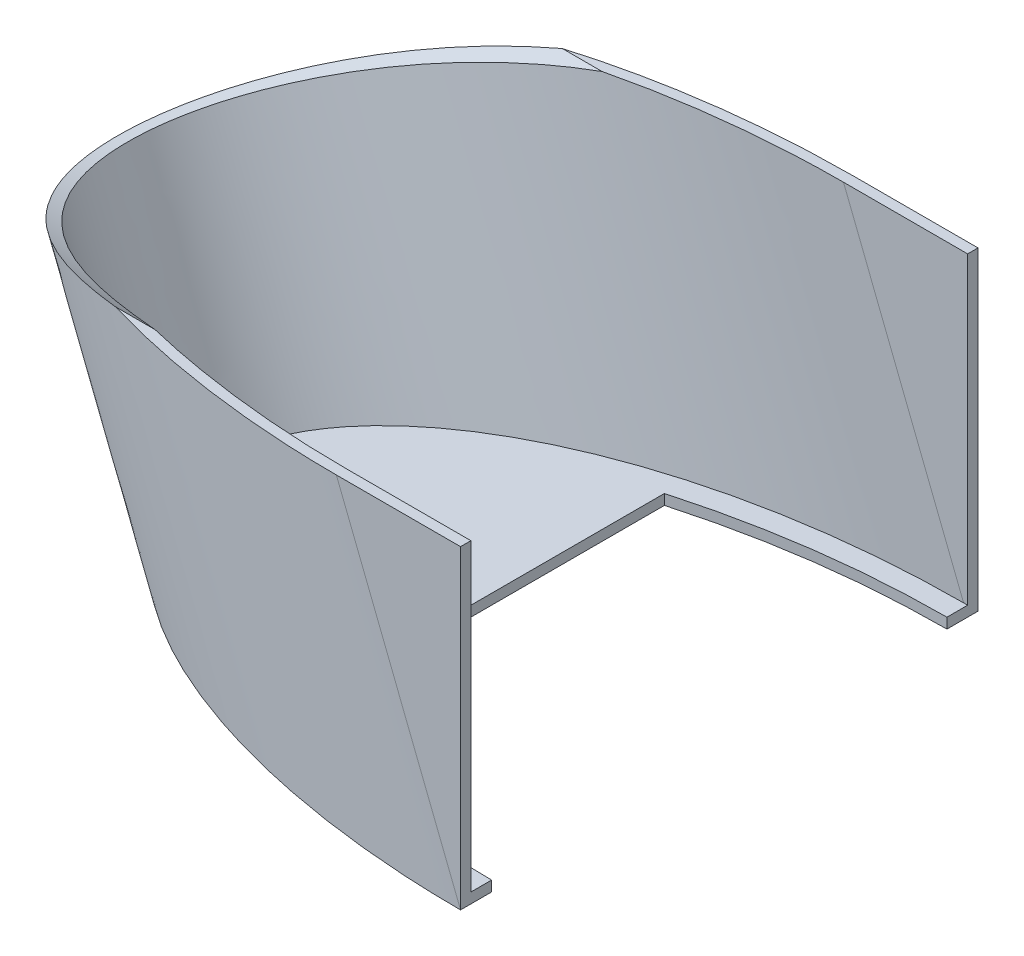
from build123d import *

# Parameters (mm, degrees)
BOSS_EXTRUDE1_DEPTH                               = 1.5875
BOSS_EXTRUDE3_DEPTH                               = 1.5875
CUT_EXTRUDE1_DEPTH                                = 99.542200549
CUT_EXTRUDE1_DEPTH_BACK                           = 99.542200549
SKETCH15_R                                        = 57.15
CSK_FOR_6_FLAT_HEAD_SOCKET_CAP_SCREW1_D           = 3.7973
CSK_FOR_6_FLAT_HEAD_SOCKET_CAP_SCREW1_CSINK_D     = 7.7978
CSK_FOR_6_FLAT_HEAD_SOCKET_CAP_SCREW1_CSINK_ANGLE = 82


with BuildPart() as part:
    # Sketch2 → Boss-Extrude1 (new body)
    with BuildSketch(Plane(origin=(0, 0, 0), x_dir=(1, 0, 0), z_dir=(0, 1, 0))):
        with BuildLine():
            Line((76.2, 39.6875), (76.2, 34.925))
            ThreePointArc((76.2, 34.925), (56.970793693, 33.609301009), (38.1, 29.686727313))
            Line((38.1, 29.686727313), (38.1, -29.686727313))
            ThreePointArc((38.1, -29.686727313), (56.970793693, -33.609301009), (76.2, -34.925))
            Line((76.2, -34.925), (76.2, -39.6875))
            add(Edge.make_bspline(
                [(76.2, 39.6875), (71.160770846, 39.6875), (66.121669874, 39.439402959), (56.232341917, 38.455848141), (51.38236517, 37.720431392), (42.05278018, 35.788211075), (37.57339889, 34.591497355), (29.151625765, 31.777872907), (25.209395979, 30.161113673), (18.007627403, 26.560229385), (14.748066442, 24.576288924), (9.033726852, 20.300232144), (6.578536208, 18.007988702), (2.577231253, 13.177986358), (1.031012909, 10.638779168), (-1.052810806, 5.400734539), (-1.5875, 2.701442433), (-1.5875, -2.701442433), (-1.052810806, -5.400734539), (1.031012909, -10.638779168), (2.577231253, -13.177986358), (6.578536208, -18.007988702), (9.033726852, -20.300232144), (14.748066442, -24.576288924), (18.007627403, -26.560229385), (25.209395979, -30.161113673), (29.151625765, -31.777872907), (37.57339889, -34.591497355), (42.05278018, -35.788211075), (51.38236517, -37.720431392), (56.232341917, -38.455848141), (66.121669874, -39.439402959), (71.160770846, -39.6875), (76.2, -39.6875)],
                knots=[0, 0, 0, 0, 0.0625, 0.0625, 0.125, 0.125, 0.1875, 0.1875, 0.25, 0.25, 0.3125, 0.3125, 0.375, 0.375, 0.4375, 0.4375, 0.5, 0.5, 0.5625, 0.5625, 0.625, 0.625, 0.6875, 0.6875, 0.75, 0.75, 0.8125, 0.8125, 0.875, 0.875, 0.9375, 0.9375, 1, 1, 1, 1], degree=3))
        make_face()
    extrude(amount=BOSS_EXTRUDE1_DEPTH)

    # Sweep3: sweep along a path in Sketch8
    with BuildLine(Plane.XY) as sweep3_path:
        Line((-1.5875, 0), (-20.6375, 48.26))
    # Sketch3 → Sweep3 (sweep)
    with BuildSketch(Plane(origin=(0, 0, 0), x_dir=(1, 0, 0), z_dir=(0, 1, 0))):
        with BuildLine():
            Line((76.2, 39.6875), (76.2, 38.1))
            add(Edge.make_bspline(
                [(76.2, 38.1), (0, 38.1), (0, 0), (0, -38.1), (76.2, -38.1)],
                knots=[1.570796327, 1.570796327, 1.570796327, 3.141592654, 3.141592654, 4.71238898, 4.71238898, 4.71238898], degree=2, weights=[1, 0.707106781, 1, 0.707106781, 1]))
            Line((76.2, -38.1), (76.2, -39.6875))
            add(Edge.make_bspline(
                [(76.2, 39.6875), (71.160770846, 39.6875), (66.121669874, 39.439402959), (56.232341917, 38.455848141), (51.38236517, 37.720431392), (42.05278018, 35.788211075), (37.57339889, 34.591497355), (29.151625765, 31.777872907), (25.209395979, 30.161113673), (18.007627403, 26.560229385), (14.748066442, 24.576288924), (9.033726852, 20.300232144), (6.578536208, 18.007988702), (2.577231253, 13.177986358), (1.031012909, 10.638779168), (-1.052810806, 5.400734539), (-1.5875, 2.701442433), (-1.5875, -2.701442433), (-1.052810806, -5.400734539), (1.031012909, -10.638779168), (2.577231253, -13.177986358), (6.578536208, -18.007988702), (9.033726852, -20.300232144), (14.748066442, -24.576288924), (18.007627403, -26.560229385), (25.209395979, -30.161113673), (29.151625765, -31.777872907), (37.57339889, -34.591497355), (42.05278018, -35.788211075), (51.38236517, -37.720431392), (56.232341917, -38.455848141), (66.121669874, -39.439402959), (71.160770846, -39.6875), (76.2, -39.6875)],
                knots=[0, 0, 0, 0, 0.0625, 0.0625, 0.125, 0.125, 0.1875, 0.1875, 0.25, 0.25, 0.3125, 0.3125, 0.375, 0.375, 0.4375, 0.4375, 0.5, 0.5, 0.5625, 0.5625, 0.625, 0.625, 0.6875, 0.6875, 0.75, 0.75, 0.8125, 0.8125, 0.875, 0.875, 0.9375, 0.9375, 1, 1, 1, 1], degree=3))
        make_face()
    sweep(path=sweep3_path.line)

    # Sketch14 → Boss-Extrude3 (add)
    with BuildSketch(Plane.XY.offset(-38.1)):
        Polygon((57.15, 48.26), (76.2, 0), (76.2, 48.26), align=None)
    boss_extrude3 = extrude(amount=-BOSS_EXTRUDE3_DEPTH)

    # Mirror2: Boss-Extrude3 across plane
    add(boss_extrude3.mirror(Plane.XY))

    # Sketch15 → Cut-Extrude1 (cut, two sides: drawn at the far end of the back side and taken through both)
    with BuildSketch(Plane(origin=(0, 0, 0), x_dir=(0, 0, -1), z_dir=(1, 0, 0)).offset(-CUT_EXTRUDE1_DEPTH_BACK)):
        with Locations((0, 93.98)):
            Circle(SKETCH15_R)
    extrude(amount=CUT_EXTRUDE1_DEPTH + CUT_EXTRUDE1_DEPTH_BACK, mode=Mode.SUBTRACT)

    # CSK for #6 Flat Head Socket Cap Screw1 (through all)
    with Locations(Plane(origin=(0, 0, 0), x_dir=(-1, 0, 0), z_dir=(0, -1, 0))):
        with Locations((-19.05, 0)):
            CounterSinkHole(CSK_FOR_6_FLAT_HEAD_SOCKET_CAP_SCREW1_D / 2, CSK_FOR_6_FLAT_HEAD_SOCKET_CAP_SCREW1_CSINK_D / 2, counter_sink_angle=CSK_FOR_6_FLAT_HEAD_SOCKET_CAP_SCREW1_CSINK_ANGLE)


solid = part.part
